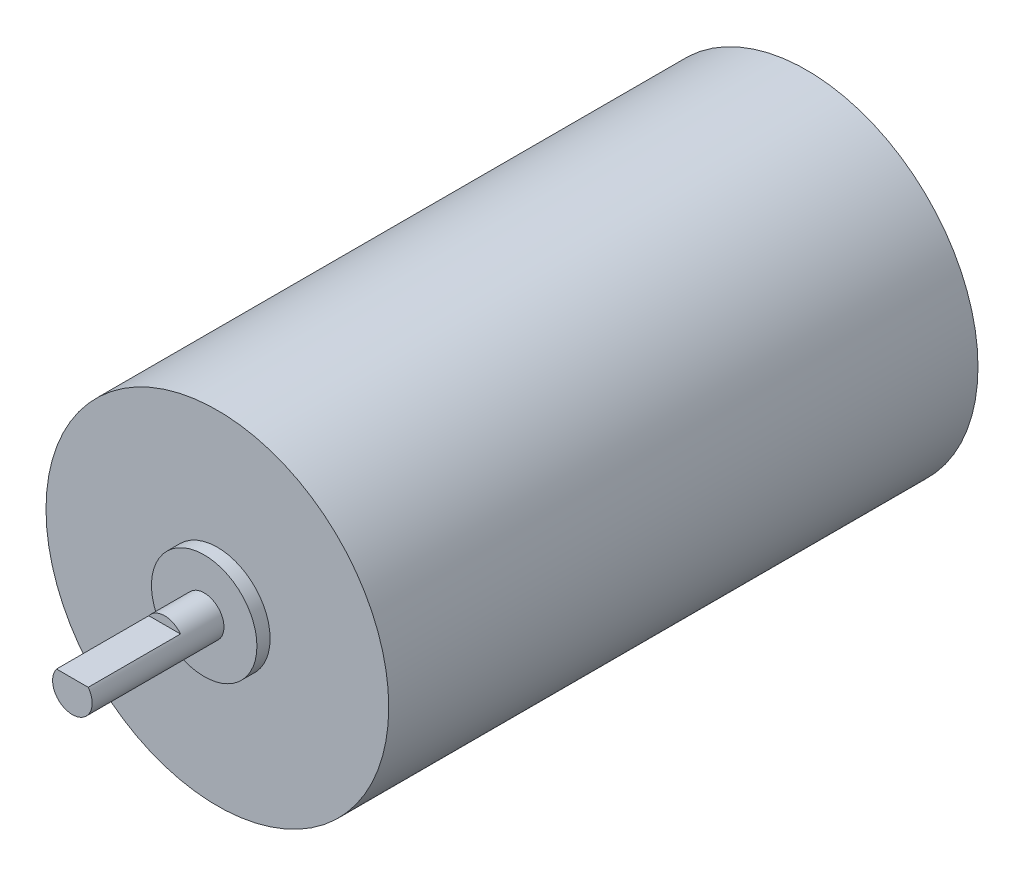
from build123d import *

# Parameters (mm, degrees)
ESQUISSE1_R             = 13
BOSS_EXTRU_1_DEPTH      = 44.7
ESQUISSE2_R             = 4
BOSS_EXTRU_2_DEPTH      = 1
ESQUISSE3_R             = 1.5
BOSS_EXTRU_3_DEPTH      = 10
ENL_V_START             = -7
ENL_V_MAT_EXTRU_1_DEPTH = 7


with BuildPart() as part:
    # Esquisse1 → Boss.-Extru.1 (new body)
    with BuildSketch(Plane.XY):
        with Locations(Location((0, 0, 0), (0, 0, 180))):
            Circle(ESQUISSE1_R)
    extrude(amount=BOSS_EXTRU_1_DEPTH)

    # Esquisse2 → Boss.-Extru.2 (add)
    with BuildSketch(Plane.XY.offset(44.7)):
        Circle(ESQUISSE2_R)
    extrude(amount=BOSS_EXTRU_2_DEPTH)

    # Esquisse3 → Boss.-Extru.3 (add)
    with BuildSketch(Plane.XY.offset(45.7)):
        Circle(ESQUISSE3_R)
    extrude(amount=BOSS_EXTRU_3_DEPTH)

    # Esquisse4 → Enlèv. mat.-Extru.1 (cut)
    with BuildSketch(Plane.XY.offset(55.7).offset(ENL_V_START)):
        with BuildLine():
            Line((-1.200903118, 0.898794582), (1.200903118, 0.898794582))
            ThreePointArc((1.200903118, 0.898794582), (0, 1.5), (-1.200903118, 0.898794582))
        make_face()
    extrude(amount=ENL_V_MAT_EXTRU_1_DEPTH, mode=Mode.SUBTRACT)


solid = part.part
